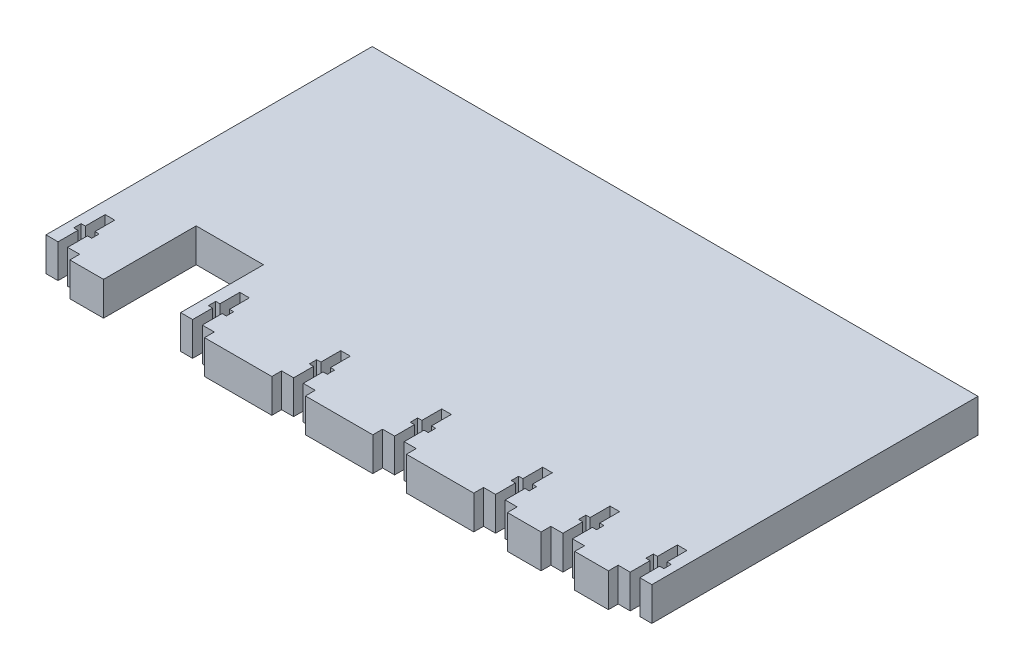
from build123d import *

# Parameters (mm, degrees)
SKETCH1_W           = 10
SKETCH1_H           = 2.907263933
SKETCH1_W_2         = 20
BOSS_EXTRUDE1_DEPTH = 10
SKETCH3_W           = 2.85
SKETCH3_H           = 14
SKETCH3_W_2         = 5.35
SKETCH3_H_2         = 2.2
CUT_EXTRUDE1_DEPTH  = 10


with BuildPart() as part:
    # Sketch1 → Boss-Extrude1 (new body)
    with BuildSketch(Plane(origin=(0, 0, 0), x_dir=(1, 0, 0), z_dir=(0, 1, 0))):
        Polygon((80, -48.454398885), (90, -48.454398885), (90, 48.454398885), (-90, 48.454398885), (-90, -48.454398885), (-80, -48.454398885), (-70, -48.454398885), (-70, -23.839564252), (-50, -23.839564252), (-50, -48.454398885), (-40, -48.454398885), (-20, -48.454398885), (-10, -48.454398885), (10, -48.454398885), (20, -48.454398885), (40, -48.454398885), (50, -48.454398885), (60, -48.454398885), (70, -48.454398885), align=None)
        with Locations((-75, -49.908030852)):
            Rectangle(SKETCH1_W, SKETCH1_H)
        with Locations((-30, -49.908030852)):
            Rectangle(SKETCH1_W_2, SKETCH1_H)
        with Locations((0, -49.908030852)):
            Rectangle(SKETCH1_W_2, SKETCH1_H)
        with Locations((30, -49.908030852)):
            Rectangle(SKETCH1_W_2, SKETCH1_H)
        with Locations((55, -49.908030852)):
            Rectangle(SKETCH1_W, SKETCH1_H)
        with Locations((75, -49.908030852)):
            Rectangle(SKETCH1_W, SKETCH1_H)
    extrude(amount=BOSS_EXTRUDE1_DEPTH)

    # Sketch3 → Cut-Extrude1 (cut)
    with BuildSketch(Plane(origin=(0, 10, 0), x_dir=(1, 0, 0), z_dir=(0, 1, 0))):
        with Locations((-85, -41.454398885)):
            Rectangle(SKETCH3_W, SKETCH3_H)
        with Locations((-85, -41.454398885)):
            Rectangle(SKETCH3_W_2, SKETCH3_H_2)
        with Locations((-45, -41.454398885)):
            Rectangle(SKETCH3_W, SKETCH3_H)
        with Locations((-45, -41.454398885)):
            Rectangle(SKETCH3_W_2, SKETCH3_H_2)
        with Locations((-15, -41.454398885)):
            Rectangle(SKETCH3_W, SKETCH3_H)
        with Locations((-15, -41.454398885)):
            Rectangle(SKETCH3_W_2, SKETCH3_H_2)
        with Locations((15, -41.454398885)):
            Rectangle(SKETCH3_W, SKETCH3_H)
        with Locations((15, -41.454398885)):
            Rectangle(SKETCH3_W_2, SKETCH3_H_2)
        with Locations((45, -41.454398885)):
            Rectangle(SKETCH3_W, SKETCH3_H)
        with Locations((45, -41.454398885)):
            Rectangle(SKETCH3_W_2, SKETCH3_H_2)
        with Locations((65, -41.454398885)):
            Rectangle(SKETCH3_W, SKETCH3_H)
        with Locations((65, -41.454398885)):
            Rectangle(SKETCH3_W_2, SKETCH3_H_2)
        with Locations((85, -41.454398885)):
            Rectangle(SKETCH3_W, SKETCH3_H)
        with Locations((85, -41.454398885)):
            Rectangle(SKETCH3_W_2, SKETCH3_H_2)
    extrude(amount=-CUT_EXTRUDE1_DEPTH, mode=Mode.SUBTRACT)


solid = part.part
